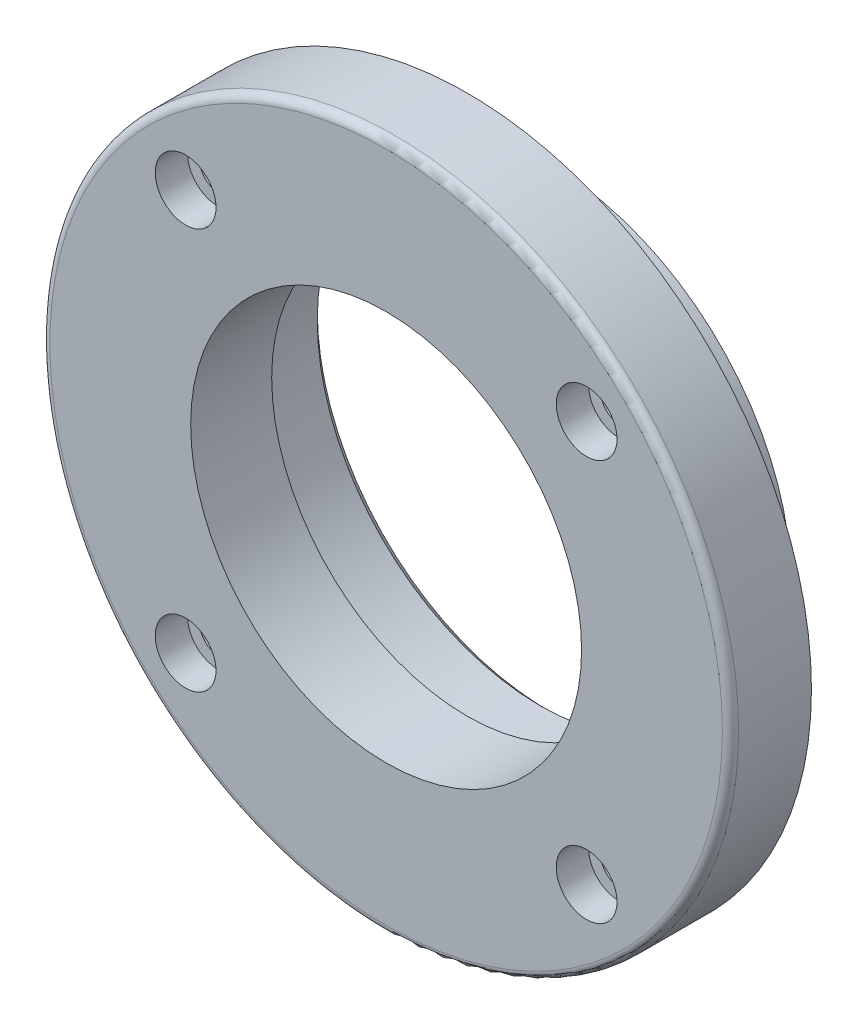
from build123d import *

# Parameters (mm, degrees)
SCHIZZO1_R                                           = 85
SCHIZZO1_R_2                                         = 48.25
ESTRUSIONE_ESTRUSIONE1_DEPTH                         = 20
SCHIZZO2_W                                           = 20
SCHIZZO2_H                                           = 5
RACCORDO1_R                                          = 2
SMUSSO1_SIZE                                         = 2
FORO_LAMATO_PER_VITE_M8_A_TESTA_CILINDRI_D           = 9
FORO_LAMATO_PER_VITE_M8_A_TESTA_CILINDRI_CBORE_D     = 15
FORO_LAMATO_PER_VITE_M8_A_TESTA_CILINDRI_CBORE_DEPTH = 8
RIPETIZIONECIRCOLARE1_COUNT                          = 4


with BuildPart() as part:
    # Schizzo1 → Estrusione-Estrusione1 (new body)
    with BuildSketch(Plane.XY):
        Circle(SCHIZZO1_R)
        Circle(SCHIZZO1_R_2, mode=Mode.SUBTRACT)
    extrude(amount=ESTRUSIONE_ESTRUSIONE1_DEPTH)

    # Schizzo2 → Rivoluzione1 (revolve)
    with BuildSketch(Plane(origin=(0, 0, 0), x_dir=(0, 0, -1), z_dir=(1, 0, 0)), mode=Mode.PRIVATE) as rivoluzione1_sk:
        with Locations((10, 57.5)):
            Rectangle(SCHIZZO2_W, SCHIZZO2_H)
    revolve(rivoluzione1_sk.sketch.rotate(Axis((0, 0, 0), (0, 0, -1)), 90), axis=Axis((0, 0, 0), (0, 0, -1)))

    # Raccordo1
    raccordo1_edges = [part.edges().sort_by_distance(p)[0] for p in [
        (-85, 0, 20),
    ]]
    fillet(raccordo1_edges, radius=RACCORDO1_R)

    # Smusso1
    smusso1_edges = [part.edges().sort_by_distance(p)[0] for p in [
        (-55, 0, -20),
    ]]
    chamfer(smusso1_edges, length=SMUSSO1_SIZE)

    # Foro lamato per Vite M8 a testa cilindrica piana-1 (through all)
    with Locations(Plane.XY.offset(20)):
        with Locations((-49.497474683, 49.497474683)):
            foro_lamato_per_vite_m8_a_testa_cilindri = CounterBoreHole(FORO_LAMATO_PER_VITE_M8_A_TESTA_CILINDRI_D / 2, FORO_LAMATO_PER_VITE_M8_A_TESTA_CILINDRI_CBORE_D / 2, FORO_LAMATO_PER_VITE_M8_A_TESTA_CILINDRI_CBORE_DEPTH)

    # RipetizioneCircolare1: Foro lamato per Vite M8 a testa cilindrica piana-1 ×4 about axis
    ripetizionecircolare1_axis = Axis((0, 0, 0), (0, 0, 1))
    for i in range(1, RIPETIZIONECIRCOLARE1_COUNT):
        add(foro_lamato_per_vite_m8_a_testa_cilindri.rotate(ripetizionecircolare1_axis, i * 360 / RIPETIZIONECIRCOLARE1_COUNT), mode=Mode.SUBTRACT)


solid = part.part
